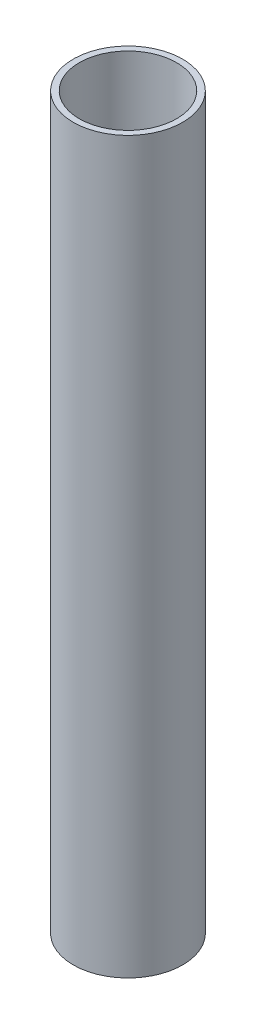
from build123d import *

# Parameters (mm, degrees)
SKETCH_1_R      = 9
SKETCH_1_R_2    = 8
EXTRUDE_1_DEPTH = 120


with BuildPart() as part:
    # 草图1 → 凸台-拉伸1 (new body)
    with BuildSketch(Plane(origin=(0, 0, 0), x_dir=(1, 0, 0), z_dir=(0, 1, 0))):
        with Locations(Location((0, 0, 0), (0, 0, 270))):
            Circle(SKETCH_1_R)
        with Locations(Location((0, 0, 0), (0, 0, 270))):
            Circle(SKETCH_1_R_2, mode=Mode.SUBTRACT)
    extrude(amount=EXTRUDE_1_DEPTH)


solid = part.part
